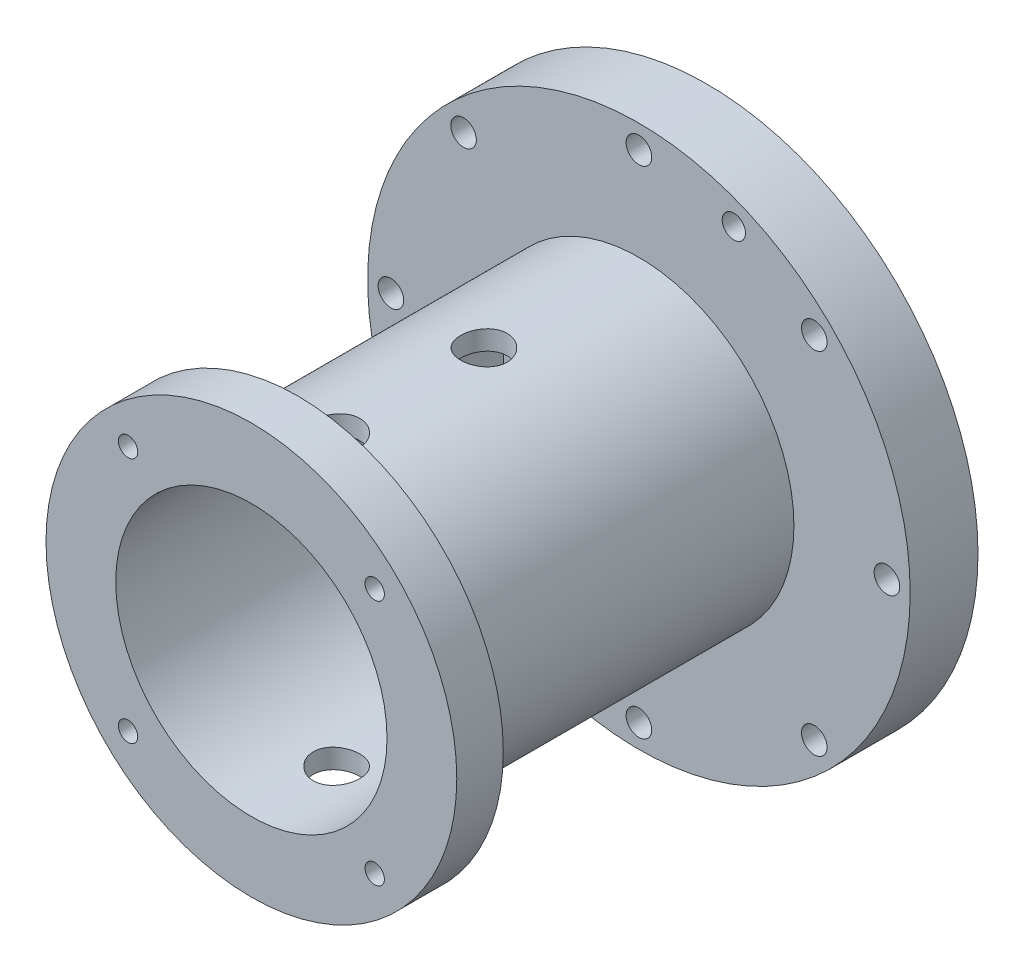
from build123d import *

# Parameters (mm, degrees)
SKETCH2_R                              = 3.3
SKETCH2_R_2                            = 3
CUT_8XTIE_D6_6_2XDOWEL_D6_PCD128_DEPTH = 150
SKETCH3_R                              = 2.5
CUT_4XM6_MOTOR_TAPS_PCD90_DEPTH        = 12
SKETCH4_R                              = 6
CUT_COUPLING_ACCESS_D12_DEPTH          = 150


with BuildPart() as part:
    # Sketch1 → REV_Input_Housing_Motor_Adapter (revolve)
    with BuildSketch(Plane(origin=(0, 0, 0), x_dir=(1, 0, 0), z_dir=(0, 1, 0))):
        Polygon((16, -13), (22, -13), (22, -19), (50, -19), (50, -7.5), (70, -7.5), (70, -25), (40, -25), (40, -113), (53, -113), (53, -125), (35, -125), (35, -25), (22, -25), (22, -54), (16, -54), (16, -35), (13.5, -35), (13.5, -25), (16, -25), align=None)
    revolve(axis=Axis((0, 0, 150), (0, 0, -1)))

    # Sketch2 → CUT_8xTie_D6.6_2xDowel_D6_PCD128 (cut, symmetric)
    with BuildSketch(Plane.XY):
        with Locations(Location((64, 0, 0), (0, 0, 180))):
            Circle(SKETCH2_R)
        with Locations(Location((45.2548, 45.2548, 0), (0, 0, 180))):
            Circle(SKETCH2_R)
        with Locations(Location((0, 64, 0), (0, 0, 180))):
            Circle(SKETCH2_R)
        with Locations(Location((-45.2548, 45.2548, 0), (0, 0, 180))):
            Circle(SKETCH2_R)
        with Locations(Location((-64, 0, 0), (0, 0, 180))):
            Circle(SKETCH2_R)
        with Locations(Location((-45.2548, -45.2548, 0), (0, 0, 180))):
            Circle(SKETCH2_R)
        with Locations(Location((0, -64, 0), (0, 0, 180))):
            Circle(SKETCH2_R)
        with Locations(Location((45.2548, -45.2548, 0), (0, 0, 180))):
            Circle(SKETCH2_R)
        with Locations(Location((24.4917, 59.1283, 0), (0, 0, 180))):
            Circle(SKETCH2_R_2)
        with Locations(Location((-24.4917, -59.1283, 0), (0, 0, 180))):
            Circle(SKETCH2_R_2)
    extrude(amount=CUT_8XTIE_D6_6_2XDOWEL_D6_PCD128_DEPTH, both=True, mode=Mode.SUBTRACT)

    # Sketch3 → CUT_4xM6_Motor_Taps_PCD90 (cut)
    with BuildSketch(Plane.XY.offset(125)):
        with Locations((31.8198, 31.8198)):
            Circle(SKETCH3_R)
        with Locations((-31.8198, 31.8198)):
            Circle(SKETCH3_R)
        with Locations((-31.8198, -31.8198)):
            Circle(SKETCH3_R)
        with Locations((31.8198, -31.8198)):
            Circle(SKETCH3_R)
    extrude(amount=-CUT_4XM6_MOTOR_TAPS_PCD90_DEPTH, mode=Mode.SUBTRACT)

    # Sketch4 → CUT_Coupling_Access_D12 (cut, symmetric)
    with BuildSketch(Plane(origin=(0, 0, 0), x_dir=(1, 0, 0), z_dir=(0, 1, 0))):
        with Locations(Location((0, -65, 0), (0, 0, 90))):
            Circle(SKETCH4_R)
        with Locations(Location((0, -103, 0), (0, 0, 90))):
            Circle(SKETCH4_R)
    extrude(amount=CUT_COUPLING_ACCESS_D12_DEPTH, both=True, mode=Mode.SUBTRACT)


solid = part.part
